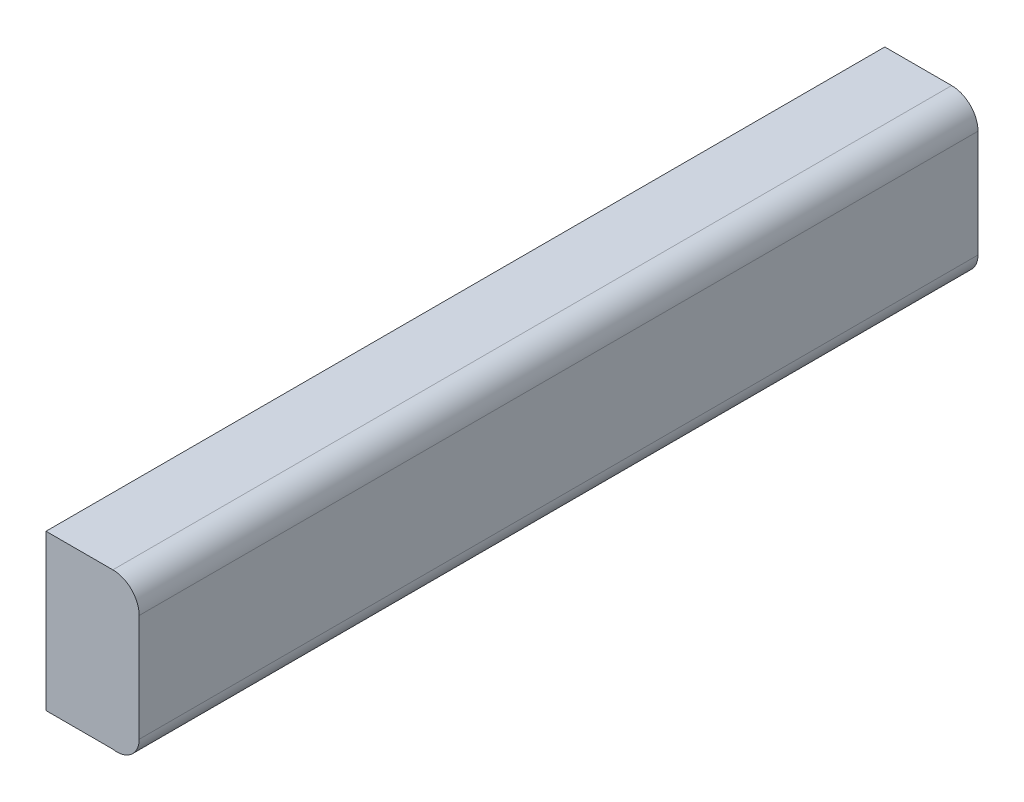
from build123d import *

# Parameters (mm, degrees)
BOSS_EXTRUDE1_DEPTH = 685.8


with BuildPart() as part:
    # Sketch1 → Boss-Extrude1 (new body)
    with BuildSketch(Plane.XY):
        with BuildLine():
            Line((0, 0), (54.656352176, 0))
            ThreePointArc((54.656352176, 0), (69.890011644, -6.309988356), (76.2, -21.543647824))
            Line((76.2, -21.543647824), (76.2, -109.19165458))
            ThreePointArc((76.2, -109.19165458), (69.620277063, -123.167221904), (54.656352176, -127))
            Line((54.656352176, -127), (0, -127))
            Line((0, -127), (0, 0))
        make_face()
    extrude(amount=BOSS_EXTRUDE1_DEPTH)


solid = part.part
